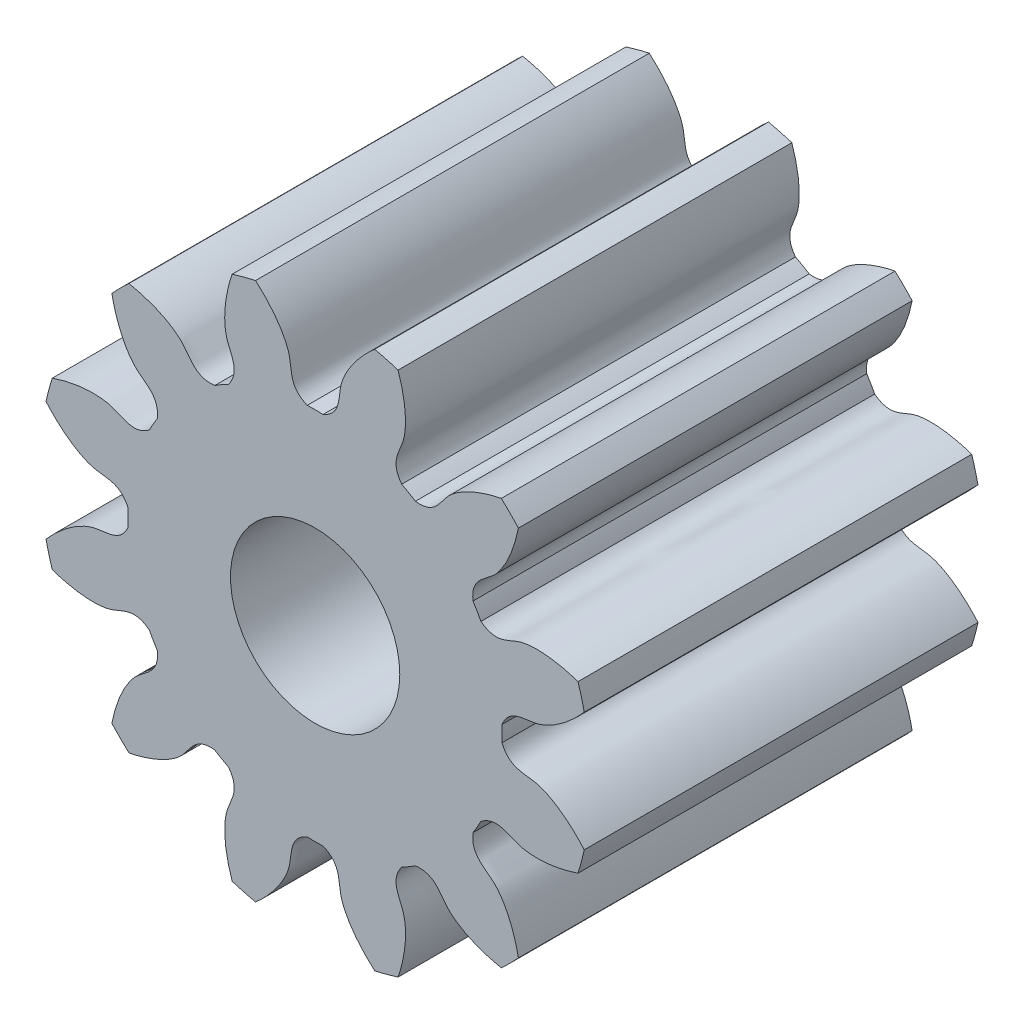
from build123d import *

# Parameters (mm, degrees)
SKETCH_1_R               = 3.5
EXTRUDE_1_DEPTH          = 5
CUT_EXTRUDE_1_DEPTH      = 8.03562364
PATTERN_CIRCULAR_1_COUNT = 12
CUT_EXTRUDE_2_REACH      = 8.954
SKETCH_4_R               = 1.075


with BuildPart() as part:
    # 草图1 → 凸台-拉伸1 (new body)
    with BuildSketch(Plane.XY):
        Circle(SKETCH_1_R)
    extrude(amount=EXTRUDE_1_DEPTH)

    # 草图2 → 切除-拉伸1 (cut, through all)
    with BuildSketch(Plane.XY):
        with BuildLine():
            ThreePointArc((0.100420056, 2.372876063), (0, 2.375), (-0.100420056, 2.372876063))
            add(Edge.make_bspline(
                [(-0.100420056, 2.372876063), (-0.340394435, 2.474653731), (-0.287186739, 2.672409341), (-0.338076094, 2.844740289), (-0.341311927, 2.854952869), (-0.345113625, 2.866166713), (-0.349521434, 2.878363044), (-0.354576313, 2.891521619), (-0.360318258, 2.905621034), (-0.36678678, 2.920638648), (-0.374020716, 2.936550626), (-0.382058239, 2.95333195), (-0.390936819, 2.970956436), (-0.400693193, 2.989396753), (-0.411363332, 3.008624444), (-0.422982412, 3.02860994), (-0.435584786, 3.049322589), (-0.449203949, 3.07073067), (-0.463872517, 3.092801417), (-0.479622192, 3.115501045), (-0.496483738, 3.138794769), (-0.514486952, 3.162646832), (-0.533660639, 3.187020528), (-0.554032585, 3.211878226), (-0.575629533, 3.237181399), (-0.598477155, 3.262890651), (-0.622600033, 3.288965742), (-0.648021632, 3.315365616), (-0.674764279, 3.342048434), (-0.702849139, 3.368971597), (-0.732296196, 3.396091781), (-0.763124233, 3.423364967), (-0.795350811, 3.450746465), (-0.828992247, 3.478190957), (-0.864063604, 3.505652518), (-0.900578664, 3.533084654), (-0.938549918, 3.560440334), (-0.977988547, 3.587672024), (-1.01890441, 3.614731718), (-1.061306025, 3.641570973), (-1.10520056, 3.668140947), (-1.150593819, 3.694392428), (-1.197490231, 3.720275872), (-1.245892835, 3.74574144), (-1.295803277, 3.770739031), (-1.347221796, 3.79521832), (-1.400147219, 3.819128792), (-1.454576948, 3.842419781), (-1.510506963, 3.865040505), (-1.567931802, 3.886940103), (-1.647189853, 3.915363979), (-1.7077968, 3.935050704), (-1.748802701, 3.947485455)],
                knots=[0, 0, 0, 0, 0.218015236, 0.222043642, 0.226545979, 0.231522246, 0.236972443, 0.24289657, 0.249294627, 0.256166614, 0.263512532, 0.271332379, 0.279626157, 0.288393865, 0.297635503, 0.307351072, 0.31754057, 0.328203999, 0.339341357, 0.350952646, 0.363037866, 0.375597015, 0.388630094, 0.402137104, 0.416118043, 0.430572913, 0.445501713, 0.460904444, 0.476781104, 0.493131694, 0.509956215, 0.527254666, 0.545027047, 0.563273358, 0.581993599, 0.601187771, 0.620855872, 0.640997904, 0.661613866, 0.682703758, 0.704267581, 0.726305333, 0.748817015, 0.771802628, 0.795262171, 0.819195644, 0.843603047, 0.868484381, 0.893839644, 0.919668838, 0.945971962, 1, 1, 1, 1], degree=3))
            ThreePointArc((-1.748802701, 3.947485455), (0, 4.317516914), (1.748802701, 3.947485455))
            add(Edge.make_bspline(
                [(0.100420056, 2.372876063), (0.340394435, 2.474653731), (0.287186739, 2.672409341), (0.338076094, 2.844740289), (0.341311927, 2.854952869), (0.345113625, 2.866166713), (0.349521434, 2.878363044), (0.354576313, 2.891521619), (0.360318258, 2.905621034), (0.36678678, 2.920638648), (0.374020716, 2.936550626), (0.382058239, 2.95333195), (0.390936819, 2.970956436), (0.400693193, 2.989396753), (0.411363332, 3.008624444), (0.422982412, 3.02860994), (0.435584786, 3.049322589), (0.449203949, 3.07073067), (0.463872517, 3.092801417), (0.479622192, 3.115501045), (0.496483738, 3.138794769), (0.514486952, 3.162646832), (0.533660639, 3.187020528), (0.554032585, 3.211878226), (0.575629533, 3.237181399), (0.598477155, 3.262890651), (0.622600033, 3.288965742), (0.648021632, 3.315365616), (0.674764279, 3.342048434), (0.702849139, 3.368971597), (0.732296196, 3.396091781), (0.763124233, 3.423364967), (0.795350811, 3.450746465), (0.828992247, 3.478190957), (0.864063604, 3.505652518), (0.900578664, 3.533084654), (0.938549918, 3.560440334), (0.977988547, 3.587672024), (1.01890441, 3.614731718), (1.061306025, 3.641570973), (1.10520056, 3.668140947), (1.150593819, 3.694392428), (1.197490231, 3.720275872), (1.245892835, 3.74574144), (1.295803277, 3.770739031), (1.347221796, 3.79521832), (1.400147219, 3.819128792), (1.454576948, 3.842419781), (1.510506963, 3.865040505), (1.567931802, 3.886940103), (1.647189853, 3.915363979), (1.7077968, 3.935050704), (1.748802701, 3.947485455)],
                knots=[0, 0, 0, 0, 0.218015236, 0.222043642, 0.226545979, 0.231522246, 0.236972443, 0.24289657, 0.249294627, 0.256166614, 0.263512532, 0.271332379, 0.279626157, 0.288393865, 0.297635503, 0.307351072, 0.31754057, 0.328203999, 0.339341357, 0.350952646, 0.363037866, 0.375597015, 0.388630094, 0.402137104, 0.416118043, 0.430572913, 0.445501713, 0.460904444, 0.476781104, 0.493131694, 0.509956215, 0.527254666, 0.545027047, 0.563273358, 0.581993599, 0.601187771, 0.620855872, 0.640997904, 0.661613866, 0.682703758, 0.704267581, 0.726305333, 0.748817015, 0.771802628, 0.795262171, 0.819195644, 0.843603047, 0.868484381, 0.893839644, 0.919668838, 0.945971962, 1, 1, 1, 1], degree=3))
        make_face()
    cut_extrude_1 = extrude(amount=CUT_EXTRUDE_1_DEPTH, mode=Mode.SUBTRACT)

    # 阵列(圆周)1: 切除-拉伸1 ×12 about axis
    pattern_circular_1_axis = Axis((0, 0, 5), (0, 0, -1))
    for i in range(1, PATTERN_CIRCULAR_1_COUNT):
        add(cut_extrude_1.rotate(pattern_circular_1_axis, i * 360 / PATTERN_CIRCULAR_1_COUNT), mode=Mode.SUBTRACT)

    # 草图4 → 切除-拉伸2 (cut, up to next)
    with BuildSketch(Plane.XY.offset(5), mode=Mode.PRIVATE) as cut_extrude_2_sk1:
        Circle(SKETCH_4_R)
    cut_extrude_2_tool1 = extrude(cut_extrude_2_sk1.sketch, amount=-CUT_EXTRUDE_2_REACH, mode=Mode.PRIVATE) & part.part
    add(cut_extrude_2_tool1.solids().sort_by_distance((0, 0, 5))[0], mode=Mode.SUBTRACT)


solid = part.part
